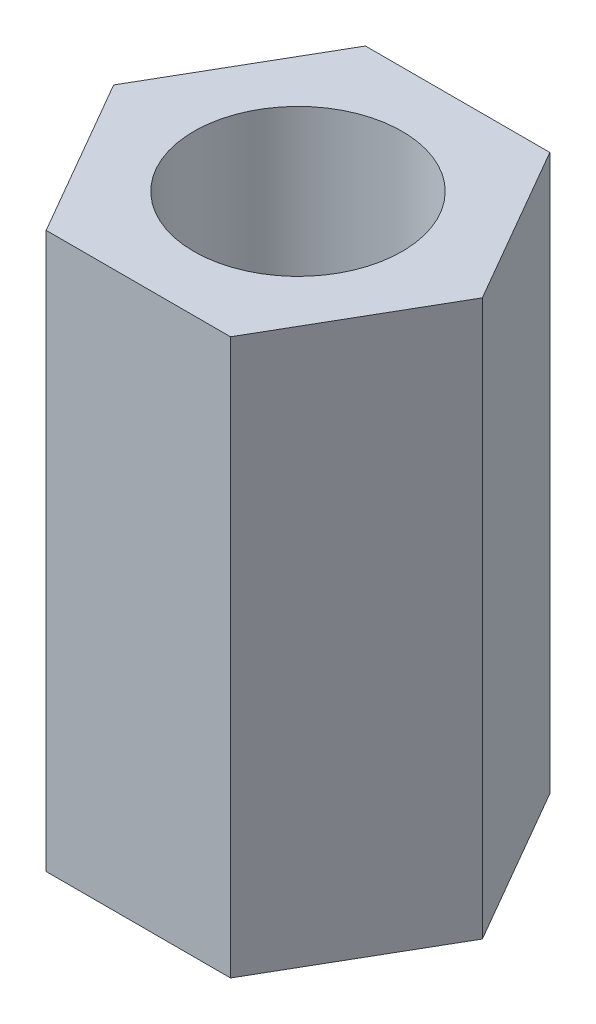
from build123d import *

# Parameters (mm, degrees)
EXTRUDE_1_DEPTH = 8
HOLE_WIZARD_1_D = 3


with BuildPart() as part:
    # 草图1 → 凸台-拉伸1 (new body)
    with BuildSketch(Plane(origin=(0, 0, 0), x_dir=(1, 0, 0), z_dir=(0, 1, 0))):
        Polygon((2.655811238, 0), (1.327905619, 2.3), (-1.327905619, 2.3), (-2.655811238, 0), (-1.327905619, -2.3), (1.327905619, -2.3), align=None)
    extrude(amount=EXTRUDE_1_DEPTH)

    # 孔1 (through all)
    with Locations(Plane(origin=(0, 8, 0), x_dir=(1, 0, 0), z_dir=(0, 1, 0))):
        with Locations((0, 0)):
            Hole(HOLE_WIZARD_1_D / 2)


solid = part.part
